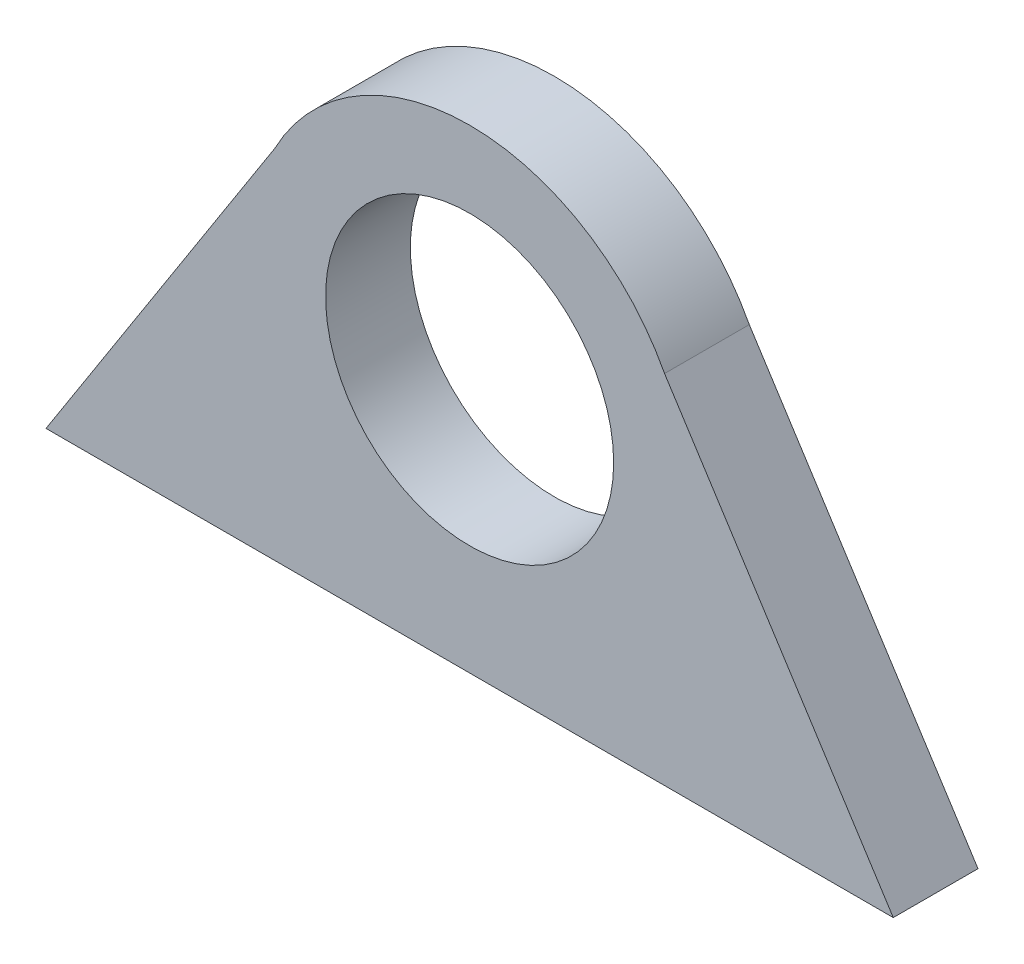
from build123d import *

# Parameters (mm, degrees)
SKETCH1_R           = 8.5
BOSS_EXTRUDE1_DEPTH = 5


with BuildPart() as part:
    # Sketch1 → Boss-Extrude1 (new body)
    with BuildSketch(Plane.XY):
        with BuildLine():
            Line((-25, -15), (25, -15))
            Line((25, -15), (11.503141901, 6.056213866))
            ThreePointArc((11.503141901, 6.056213866), (-0.001070183, 12.999999956), (-11.504138862, 6.054319866))
            Line((-11.504138862, 6.054319866), (-25, -15))
        make_face()
        Circle(SKETCH1_R, mode=Mode.SUBTRACT)
    extrude(amount=BOSS_EXTRUDE1_DEPTH)


solid = part.part
